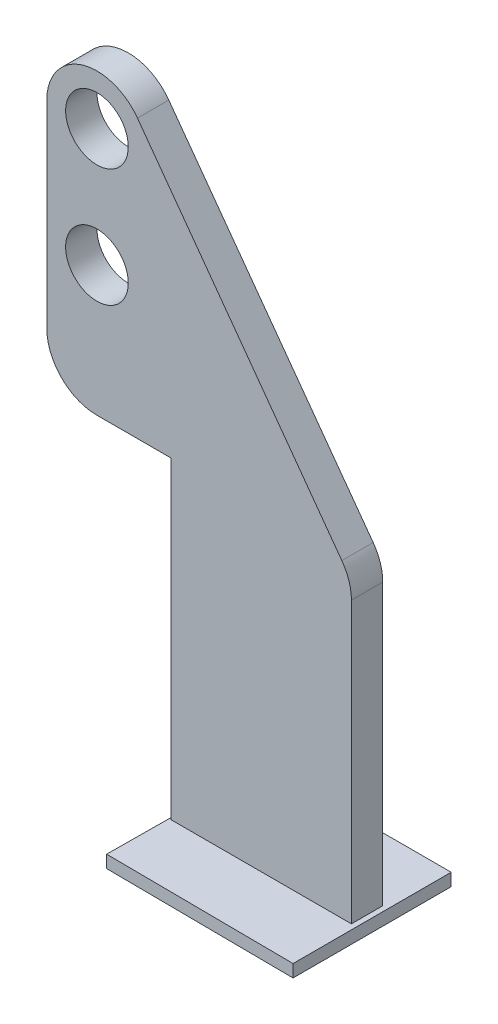
from build123d import *

# Parameters (mm, degrees)
SKETCH1_R           = 1.27
BOSS_EXTRUDE1_DEPTH = 1.27
BOSS_EXTRUDE2_DEPTH = 0.508


with BuildPart() as part:
    # Sketch1 → Boss-Extrude1 (new body)
    with BuildSketch(Plane.XY):
        with BuildLine():
            Line((6.924783114, -0.138801739), (-1.3615811, 11.254923221))
            ThreePointArc((-1.3615811, 11.254923221), (-3.633316734, 11.992153009), (-5.036931534, 10.059756558))
            Line((-5.036931534, 10.059756558), (-5.036931534, 2.032))
            ThreePointArc((-5.036931534, 2.032), (-4.441772513, 0.595159021), (-3.004931534, 0))
            Line((-3.004931534, 0), (0, 0))
            Line((0, 0), (0, -12.7))
            Line((0, -12.7), (7.31343268, -12.7))
            Line((7.31343268, -12.7), (7.31343268, -1.333968401))
            ThreePointArc((7.31343268, -1.333968401), (7.21382913, -0.705583202), (6.924783114, -0.138801739))
        make_face()
        with Locations((-3.004931534, 10.059756558)):
            Circle(SKETCH1_R, mode=Mode.SUBTRACT)
        with Locations((-3.004931534, 5.27395868)):
            Circle(SKETCH1_R, mode=Mode.SUBTRACT)
    extrude(amount=BOSS_EXTRUDE1_DEPTH)

    # Sketch2 → Boss-Extrude2 (add)
    with BuildSketch(Plane(origin=(0, -12.7, 0), x_dir=(-1, 0, 0), z_dir=(0, -1, 0))):
        Polygon((-7.52318228, 2.564928968), (-7.52318228, -3.846337758), (0.09681772, -3.785071032), (0.045762115, 2.564928968), align=None)
    extrude(amount=BOSS_EXTRUDE2_DEPTH)


solid = part.part
